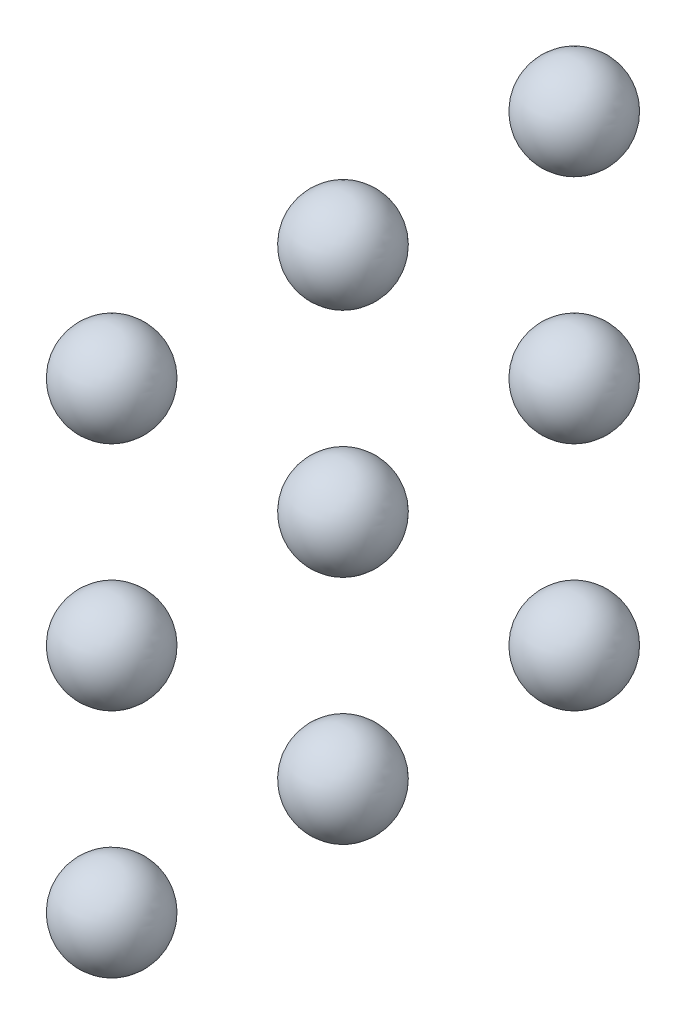
from build123d import *

# Parameters (mm, degrees)
PATTERN_LINEAR_3_COUNT   = 3
PATTERN_LINEAR_3_PITCH   = 20
PATTERN_LINEAR_3_2_COUNT = 3
PATTERN_LINEAR_3_2_PITCH = 20


with BuildPart() as part:
    # 草图2 → 旋转5 (revolve)
    with BuildSketch(Plane.XY):
        with BuildLine():
            Line((0, 4), (0, -4))
            ThreePointArc((0, -4), (-4, 0), (0, 4))
        make_face()
    revolve(axis=Axis((0, 4, 0), (0, -1, 0)))


with BuildPart() as pattern_linear_3_1:
    # 阵列(线性)3: pattern copy
    add(part.part.moved(Location(Vector(0, 0, 1) * (1 * PATTERN_LINEAR_3_PITCH))))


with BuildPart() as pattern_linear_3_2:
    # 阵列(线性)3: pattern copy
    add(part.part.moved(Location(Vector(0, 0, 1) * (2 * PATTERN_LINEAR_3_PITCH))))


with BuildPart() as pattern_linear_3_2_1:
    # Pattern Linear 3 2: pattern copy
    add(part.part.moved(Location(Vector(0, 1, 0) * (1 * PATTERN_LINEAR_3_2_PITCH))))


with BuildPart() as pattern_linear_3_2_2:
    # Pattern Linear 3 2: pattern copy
    add(part.part.moved(Location(Vector(0, 1, 0) * (2 * PATTERN_LINEAR_3_2_PITCH))))


with BuildPart() as pattern_linear_3_2_3:
    # Pattern Linear 3 2: pattern copy
    add(pattern_linear_3_1.part.moved(Location(Vector(0, 1, 0) * (1 * PATTERN_LINEAR_3_2_PITCH))))


with BuildPart() as pattern_linear_3_2_4:
    # Pattern Linear 3 2: pattern copy
    add(pattern_linear_3_1.part.moved(Location(Vector(0, 1, 0) * (2 * PATTERN_LINEAR_3_2_PITCH))))


with BuildPart() as pattern_linear_3_2_5:
    # Pattern Linear 3 2: pattern copy
    add(pattern_linear_3_2.part.moved(Location(Vector(0, 1, 0) * (1 * PATTERN_LINEAR_3_2_PITCH))))


with BuildPart() as pattern_linear_3_2_6:
    # Pattern Linear 3 2: pattern copy
    add(pattern_linear_3_2.part.moved(Location(Vector(0, 1, 0) * (2 * PATTERN_LINEAR_3_2_PITCH))))


solid = Compound([part.part, pattern_linear_3_1.part, pattern_linear_3_2.part, pattern_linear_3_2_1.part, pattern_linear_3_2_2.part, pattern_linear_3_2_3.part, pattern_linear_3_2_4.part, pattern_linear_3_2_5.part, pattern_linear_3_2_6.part])
